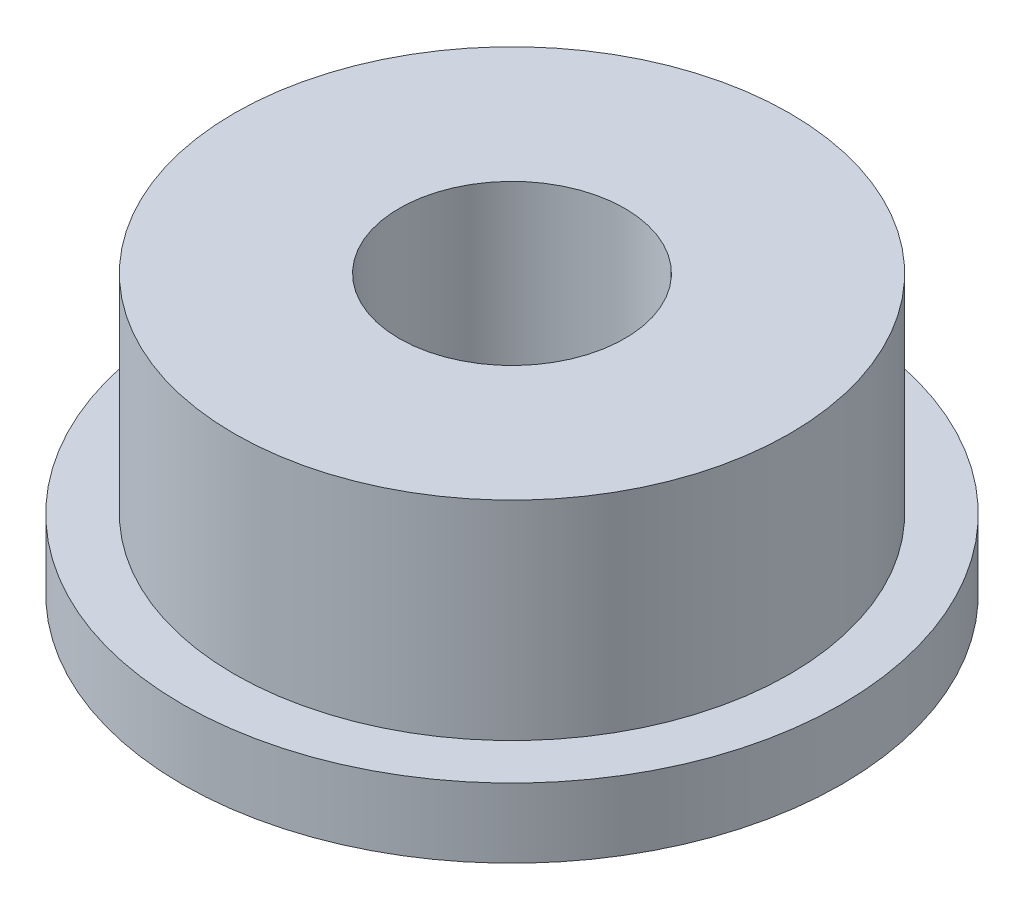
from build123d import *

# Parameters (mm, degrees)
SKETCH1_R           = 4.75
SKETCH1_R_2         = 1.625
BOSS_EXTRUDE1_DEPTH = 1
SKETCH2_R           = 4
SKETCH2_R_2         = 1.625
BOSS_EXTRUDE2_DEPTH = 3


with BuildPart() as part:
    # Sketch1 → Boss-Extrude1 (new body)
    with BuildSketch(Plane(origin=(0, 0, 0), x_dir=(1, 0, 0), z_dir=(0, 1, 0))):
        with Locations(Location((0, 0, 0), (0, 0, 270))):
            Circle(SKETCH1_R)
        with Locations(Location((0, 0, 0), (0, 0, 270))):
            Circle(SKETCH1_R_2, mode=Mode.SUBTRACT)
    extrude(amount=BOSS_EXTRUDE1_DEPTH)

    # Sketch2 → Boss-Extrude2 (add)
    with BuildSketch(Plane(origin=(0, 1, 0), x_dir=(1, 0, 0), z_dir=(0, 1, 0))):
        with Locations(Location((0, 0, 0), (0, 0, 270))):
            Circle(SKETCH2_R)
        with Locations(Location((0, 0, 0), (0, 0, 270))):
            Circle(SKETCH2_R_2, mode=Mode.SUBTRACT)
    extrude(amount=BOSS_EXTRUDE2_DEPTH)


solid = part.part
